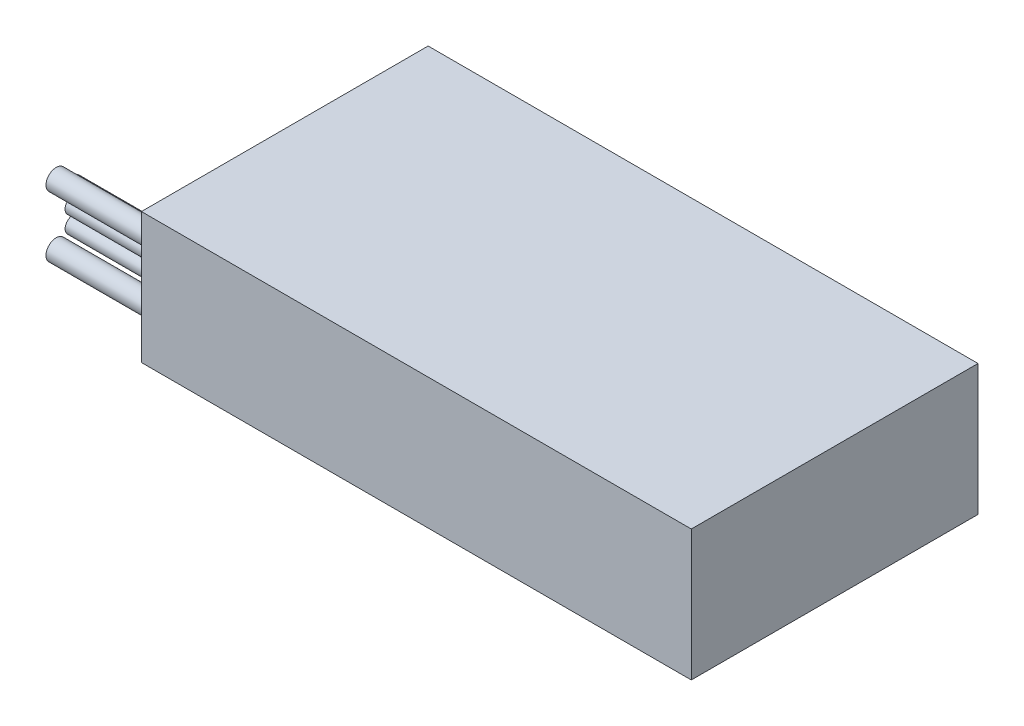
from build123d import *

# Parameters (mm, degrees)
SKETCH1_W           = 67.7
SKETCH1_H           = 16.1
BOSS_EXTRUDE1_DEPTH = 35.3
SKETCH3_R           = 1
SKETCH3_R_2         = 1.25
BOSS_EXTRUDE2_DEPTH = 13


with BuildPart() as part:
    # Sketch1 → Boss-Extrude1 (new body)
    with BuildSketch(Plane.XY):
        with Locations((33.85, 8.05)):
            Rectangle(SKETCH1_W, SKETCH1_H)
    extrude(amount=BOSS_EXTRUDE1_DEPTH)

    # Sketch3 → Boss-Extrude2 (add)
    with BuildSketch(Plane.ZY):
        with Locations(Location((30.7, 10.15, 0), (0, 0, 180))):
            Circle(SKETCH3_R)
        with Locations(Location((30.7, 8.05, 0), (0, 0, 180))):
            Circle(SKETCH3_R)
        with Locations(Location((30.7, 5.95, 0), (0, 0, 180))):
            Circle(SKETCH3_R)
        with Locations(Location((32.8, 4.3, 0), (0, 0, 180))):
            Circle(SKETCH3_R_2)
        with Locations(Location((32.8, 11.8, 0), (0, 0, 180))):
            Circle(SKETCH3_R_2)
    extrude(amount=BOSS_EXTRUDE2_DEPTH)


solid = part.part
